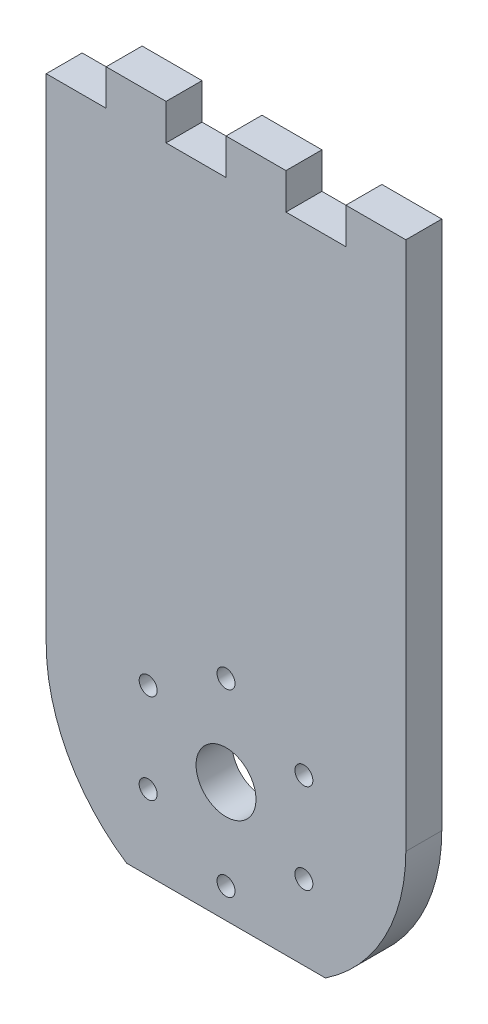
from build123d import *

# Parameters (mm, degrees)
SALIENTE_EXTRUIR1_DEPTH = 3
CORTAR_EXTRUIR1_DEPTH   = 3
CORTAR_EXTRUIR2_REACH   = 34.209
CROQUIS3_R              = 0.75
CROQUIS3_R_2            = 2.5


with BuildPart() as part:
    # Croquis1 → Saliente-Extruir1 (new body)
    with BuildSketch(Plane.XY):
        Polygon((-15, -28.345), (15, -28.345), (15, 28.345), (10, 28.345), (10, 25.345), (5, 25.345), (5, 28.345), (0, 28.345), (0, 25.345), (-5, 25.345), (-5, 28.345), (-10, 28.345), (-10, 25.345), (-15, 25.345), align=None)
    extrude(amount=SALIENTE_EXTRUIR1_DEPTH)

    # Croquis2 → Cortar-Extruir1 (cut)
    with BuildSketch(Plane(origin=(0, 0, 0), x_dir=(-1, 0, 0), z_dir=(0, 0, -1))):
        with BuildLine():
            Line((-15, -15.845), (-21.186751232, -15.845))
            Line((-21.186751232, -15.845), (-21.186751232, -34.648085908))
            Line((-21.186751232, -34.648085908), (21.188955731, -34.648085908))
            Line((21.188955731, -34.648085908), (21.188955731, -15.845))
            Line((21.188955731, -15.845), (15, -15.845))
            ThreePointArc((15, -15.845), (0, -30.845), (-15, -15.845))
        make_face()
    extrude(amount=-CORTAR_EXTRUIR1_DEPTH, mode=Mode.SUBTRACT)

    # Croquis3 → Cortar-Extruir2 (cut, up to next)
    with BuildSketch(Plane(origin=(0, 0, 0), x_dir=(-1, 0, 0), z_dir=(0, 0, -1)), mode=Mode.PRIVATE) as cortar_extruir2_sk1:
        with Locations((0, -10.845)):
            Circle(CROQUIS3_R)
    cortar_extruir2_tool1 = extrude(cortar_extruir2_sk1.sketch, amount=-CORTAR_EXTRUIR2_REACH, mode=Mode.PRIVATE) & part.part
    # Croquis3 → Cortar-Extruir2 (cut, up to next)
    with BuildSketch(Plane(origin=(0, 0, 0), x_dir=(-1, 0, 0), z_dir=(0, 0, -1)), mode=Mode.PRIVATE) as cortar_extruir2_sk2:
        with Locations((6.495190528, -14.595)):
            Circle(CROQUIS3_R)
    cortar_extruir2_tool2 = extrude(cortar_extruir2_sk2.sketch, amount=-CORTAR_EXTRUIR2_REACH, mode=Mode.PRIVATE) & part.part
    # Croquis3 → Cortar-Extruir2 (cut, up to next)
    with BuildSketch(Plane(origin=(0, 0, 0), x_dir=(-1, 0, 0), z_dir=(0, 0, -1)), mode=Mode.PRIVATE) as cortar_extruir2_sk3:
        with Locations((6.495190528, -22.095)):
            Circle(CROQUIS3_R)
    cortar_extruir2_tool3 = extrude(cortar_extruir2_sk3.sketch, amount=-CORTAR_EXTRUIR2_REACH, mode=Mode.PRIVATE) & part.part
    # Croquis3 → Cortar-Extruir2 (cut, up to next)
    with BuildSketch(Plane(origin=(0, 0, 0), x_dir=(-1, 0, 0), z_dir=(0, 0, -1)), mode=Mode.PRIVATE) as cortar_extruir2_sk4:
        with Locations((0, -25.845)):
            Circle(CROQUIS3_R)
    cortar_extruir2_tool4 = extrude(cortar_extruir2_sk4.sketch, amount=-CORTAR_EXTRUIR2_REACH, mode=Mode.PRIVATE) & part.part
    # Croquis3 → Cortar-Extruir2 (cut, up to next)
    with BuildSketch(Plane(origin=(0, 0, 0), x_dir=(-1, 0, 0), z_dir=(0, 0, -1)), mode=Mode.PRIVATE) as cortar_extruir2_sk5:
        with Locations((-6.495190528, -22.095)):
            Circle(CROQUIS3_R)
    cortar_extruir2_tool5 = extrude(cortar_extruir2_sk5.sketch, amount=-CORTAR_EXTRUIR2_REACH, mode=Mode.PRIVATE) & part.part
    # Croquis3 → Cortar-Extruir2 (cut, up to next)
    with BuildSketch(Plane(origin=(0, 0, 0), x_dir=(-1, 0, 0), z_dir=(0, 0, -1)), mode=Mode.PRIVATE) as cortar_extruir2_sk6:
        with Locations((-6.495190528, -14.595)):
            Circle(CROQUIS3_R)
    cortar_extruir2_tool6 = extrude(cortar_extruir2_sk6.sketch, amount=-CORTAR_EXTRUIR2_REACH, mode=Mode.PRIVATE) & part.part
    # Croquis3 → Cortar-Extruir2 (cut, up to next)
    with BuildSketch(Plane(origin=(0, 0, 0), x_dir=(-1, 0, 0), z_dir=(0, 0, -1)), mode=Mode.PRIVATE) as cortar_extruir2_sk7:
        with Locations((0, -18.345)):
            Circle(CROQUIS3_R_2)
    cortar_extruir2_tool7 = extrude(cortar_extruir2_sk7.sketch, amount=-CORTAR_EXTRUIR2_REACH, mode=Mode.PRIVATE) & part.part
    add(cortar_extruir2_tool1.solids().sort_by_distance((0, -10.845, 0))[0], mode=Mode.SUBTRACT)
    add(cortar_extruir2_tool2.solids().sort_by_distance((-6.495191, -14.595, 0))[0], mode=Mode.SUBTRACT)
    add(cortar_extruir2_tool3.solids().sort_by_distance((-6.495191, -22.095, 0))[0], mode=Mode.SUBTRACT)
    add(cortar_extruir2_tool4.solids().sort_by_distance((0, -25.845, 0))[0], mode=Mode.SUBTRACT)
    add(cortar_extruir2_tool5.solids().sort_by_distance((6.495191, -22.095, 0))[0], mode=Mode.SUBTRACT)
    add(cortar_extruir2_tool6.solids().sort_by_distance((6.495191, -14.595, 0))[0], mode=Mode.SUBTRACT)
    add(cortar_extruir2_tool7.solids().sort_by_distance((0, -18.345, 0))[0], mode=Mode.SUBTRACT)


solid = part.part
